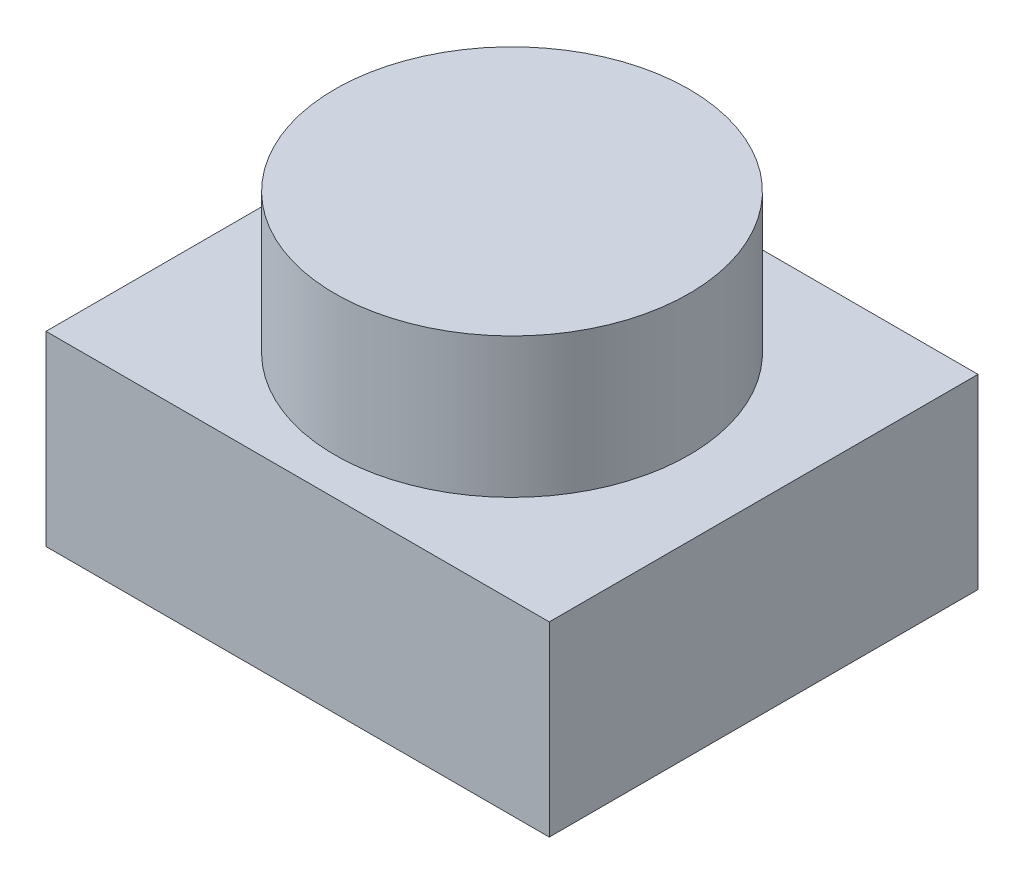
from build123d import *

# Parameters (mm, degrees)
SK_BASE_W  = 54
SK_BASE_H  = 20
BASE_DEPTH = 23
SK_HEAD_W  = 19
SK_HEAD_H  = 15


with BuildPart() as part:
    # SK_Base → Base (new, symmetric)
    with BuildSketch(Plane.XY):
        with Locations((0, 10)):
            Rectangle(SK_BASE_W, SK_BASE_H)
    extrude(amount=BASE_DEPTH, both=True)

    # SK_Head → Head (revolve)
    with BuildSketch(Plane.XY, mode=Mode.PRIVATE) as head_sk:
        with Locations((9.5, 27.5)):
            Rectangle(SK_HEAD_W, SK_HEAD_H)
    revolve(head_sk.sketch.rotate(Axis((0, 15, 0), (0, 1, 0)), 90), axis=Axis((0, 15, 0), (0, 1, 0)))


solid = part.part
